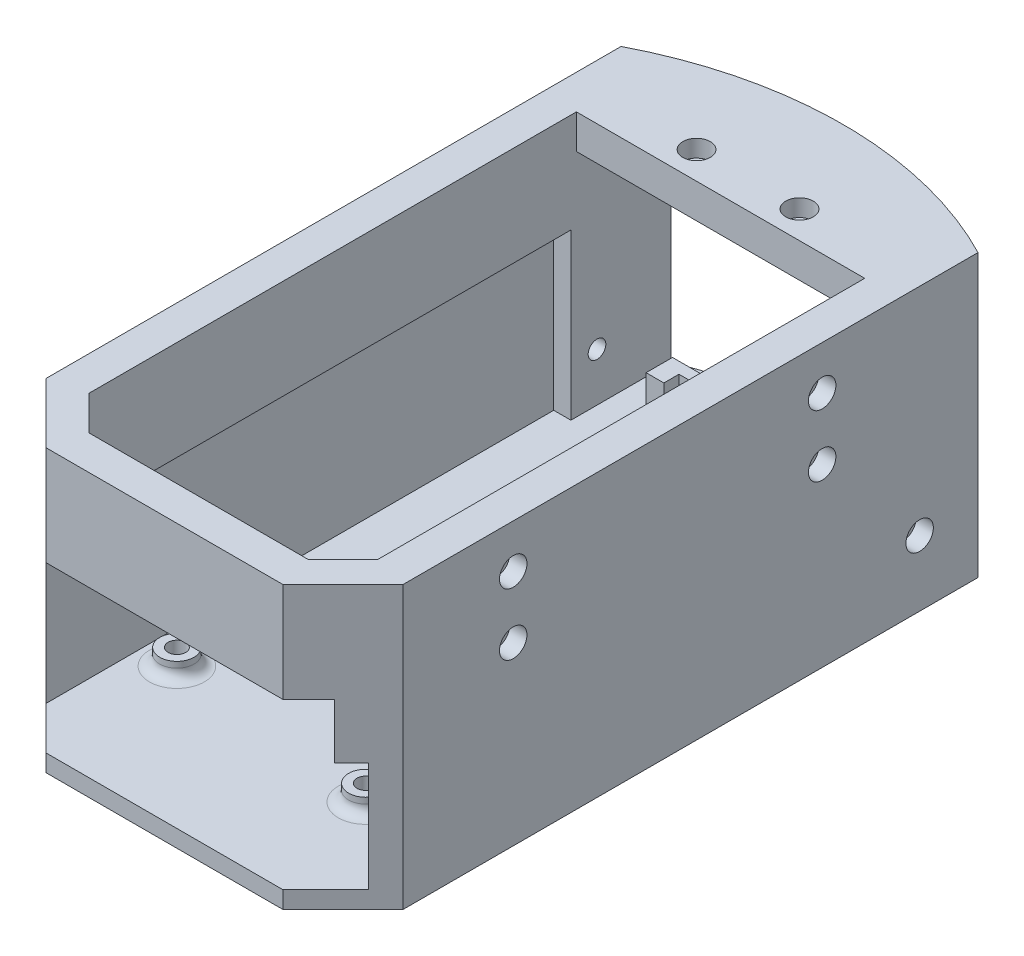
from build123d import *

# Parameters (mm, degrees)
SKETCH1_W                 = 66.04
SKETCH1_H                 = 52.07
SKETCH1_W_2               = 53.34
SKETCH1_H_2               = 42.545
BOSS_EXTRUDE1_DEPTH       = 152.4
SKETCH3_W                 = 53.34
SKETCH3_H                 = 129.7432
CUT_EXTRUDE2_DEPTH        = 48.895
BOSS_EXTRUDE3_DEPTH       = 48.895
SKETCH6_W                 = 177.8
SKETCH6_H                 = 203.2
CUT_EXTRUDE3_DEPTH        = 165.400016119
F_4_CLEARANCE_HOLE3_D     = 3.2639
F_4_CLEARANCE_HOLE3_DEPTH = 6.35
SKETCH12_R                = 2.54
CUT_EXTRUDE5_DEPTH        = 3.175
SKETCH15_R                = 2.54
CUT_EXTRUDE6_DEPTH        = 3.175
CUT_EXTRUDE9_DEPTH        = 101.854
SKETCH18_W                = 29.718
SKETCH18_H                = 4.88696
SD_CARD_HOLDER_DEPTH      = 13.9954
SKETCH19_W                = 24.3332
SKETCH19_H                = 5.6388
CUT_EXTRUDE10_DEPTH       = 2.794
SKETCH20_R                = 3.175
MOUNT_POST_DEPTH          = 3
F_4_CLEARANCE_HOLE1_D     = 3.2639
CUT_EXTRUDE11_DEPTH       = 1.905
F_4_CLEARANCE_HOLE2_D     = 3.2639
F_4_CLEARANCE_HOLE2_DEPTH = 6.35
SKETCH27_R                = 2.54
CUT_EXTRUDE13_DEPTH       = 3.175
FILLET1_R                 = 1.905
FILLET2_R                 = 1.905
CUT_EXTRUDE15_START       = -52.07
CUT_EXTRUDE15_DEPTH       = 52.07
BOSS_EXTRUDE8_DEPTH       = 107.95
FILLET3_R                 = 1.27
SKETCH32_W                = 38.1
SKETCH32_H                = 6.35
CUT_EXTRUDE16_DEPTH       = 146.211577855


with BuildPart() as part:
    # Sketch1 → Boss-Extrude1 (new body)
    with BuildSketch(Plane.XY):
        Rectangle(SKETCH1_W, SKETCH1_H)
        with Locations((0, -1.5875)):
            Rectangle(SKETCH1_W_2, SKETCH1_H_2, mode=Mode.SUBTRACT)
    extrude(amount=BOSS_EXTRUDE1_DEPTH)

    # Sketch3 → Cut-Extrude2 (cut)
    with BuildSketch(Plane(origin=(0, 26.035, 0), x_dir=(1, 0, 0), z_dir=(0, 1, 0))):
        with Locations((0, -87.5284)):
            Rectangle(SKETCH3_W, SKETCH3_H)
    extrude(amount=-CUT_EXTRUDE2_DEPTH, mode=Mode.SUBTRACT)

    # Sketch5 → Boss-Extrude3 (add)
    with BuildSketch(Plane(origin=(0, 26.035, 0), x_dir=(1, 0, 0), z_dir=(0, 1, 0))):
        Polygon((20.32, -119.1768), (26.67, -119.1768), (26.67, -112.8268), align=None)
        Polygon((-26.67, -119.1768), (-20.32, -119.1768), (-26.67, -112.8268), align=None)
        Polygon((0, -152.4), (0, -119.1768), (-20.32, -119.1768), (-26.67, -119.1768), (-26.67, -152.4), align=None)
        Polygon((26.67, -152.4), (26.67, -119.1768), (20.32, -119.1768), (0, -119.1768), (0, -152.4), align=None)
    extrude(amount=-BOSS_EXTRUDE3_DEPTH)

    # Sketch6 → Cut-Extrude3 (cut, through all)
    with BuildSketch(Plane(origin=(0, 26.035, 0), x_dir=(1, 0, 0), z_dir=(0, 1, 0))):
        with Locations((2.791033984, -70.453804893)):
            Rectangle(SKETCH6_W, SKETCH6_H)
        with BuildLine():
            Line((44.5826875, -125.5268), (-44.5826875, -125.5268))
            ThreePointArc((-44.5826875, -125.5268), (-69.844182534, -70.853519983), (-43.18, -16.850445544))
            Line((-43.18, -16.850445544), (-44.357636364, -15.353048604))
            ThreePointArc((-44.357636364, -15.353048604), (0, 0), (44.357636364, -15.353048604))
            Line((44.357636364, -15.353048604), (43.18, -16.850445544))
            ThreePointArc((43.18, -16.850445544), (69.844182534, -70.853519983), (44.5826875, -125.5268))
        make_face(mode=Mode.SUBTRACT)
    extrude(amount=-CUT_EXTRUDE3_DEPTH, mode=Mode.SUBTRACT)

    # #4 Clearance Hole3
    with Locations(Plane(origin=(0, 26.035, 0), x_dir=(1, 0, 0), z_dir=(0, 1, 0))):
        with Locations((-9.525, -17.5768), (9.525, -17.5768)):
            Hole(F_4_CLEARANCE_HOLE3_D / 2, depth=F_4_CLEARANCE_HOLE3_DEPTH)

    # Sketch12 → Cut-Extrude5 (cut)
    with BuildSketch(Plane(origin=(0, 26.035, 0), x_dir=(1, 0, 0), z_dir=(0, 1, 0))):
        with Locations(Location((-9.525, -17.5768, 0), (0, 0, 180))):
            Circle(SKETCH12_R)
        with Locations(Location((9.525, -17.5768, 0), (0, 0, 180))):
            Circle(SKETCH12_R)
    extrude(amount=-CUT_EXTRUDE5_DEPTH, mode=Mode.SUBTRACT)

    # Sketch13 → #4 Clearance Hole4 (revolve, cut)
    with BuildSketch(Plane(origin=(-26.67, -13.9065, 18.8468), x_dir=(0, 0, -1), z_dir=(0, 1, 0))):
        Polygon((0, 0), (0, 13.680574487), (1.63195, 12.7), (1.63195, 0), align=None)
    f_4_clearance_hole4 = revolve(axis=Axis((-20.32, -13.9065, 18.8468), (-1, 0, 0)), mode=Mode.SUBTRACT)

    # Sketch15 → Cut-Extrude6 (cut)
    with BuildSketch(Plane.ZY.offset(33.02)):
        with Locations((18.8468, -13.9065)):
            Circle(SKETCH15_R)
    cut_extrude6 = extrude(amount=-CUT_EXTRUDE6_DEPTH, mode=Mode.SUBTRACT)

    # Mirror1: #4 Clearance Hole4, Cut-Extrude6 across plane
    add(f_4_clearance_hole4.mirror(Plane(origin=(0, 0, 0), x_dir=(0, 0, 1), z_dir=(1, 0, 0))), mode=Mode.SUBTRACT)
    add(cut_extrude6.mirror(Plane(origin=(0, 0, 0), x_dir=(0, 0, 1), z_dir=(1, 0, 0))), mode=Mode.SUBTRACT)

    # Sketch16 → Cut-Extrude9 (cut)
    with BuildSketch(Plane(origin=(0, 0, 125.5268), x_dir=(-1, 0, 0), z_dir=(0, 0, -1))):
        Polygon((-26.67, 7.62), (29.845, 7.62), (29.845, -22.86), (-29.845, -22.86), (-29.845, -2.54), (-26.67, -2.54), align=None)
    extrude(amount=CUT_EXTRUDE9_DEPTH, mode=Mode.SUBTRACT)

    # Sketch18 → SD card holder (add)
    with BuildSketch(Plane(origin=(0, -22.86, 0), x_dir=(1, 0, 0), z_dir=(0, 1, 0))):
        with Locations((1.524, -20.65528)):
            Rectangle(SKETCH18_W, SKETCH18_H)
    extrude(amount=SD_CARD_HOLDER_DEPTH)

    # Sketch19 → Cut-Extrude10 (cut)
    with BuildSketch(Plane.XY.offset(23.09876)):
        with Locations((2.1209, -11.684)):
            Rectangle(SKETCH19_W, SKETCH19_H)
    extrude(amount=-CUT_EXTRUDE10_DEPTH, mode=Mode.SUBTRACT)

    # Sketch20 → mount post (add)
    with BuildSketch(Plane(origin=(0, -22.86, 0), x_dir=(1, 0, 0), z_dir=(0, 1, 0))):
        with Locations(Location((-9.88187, -49.20376, 0), (0, 0, 180))):
            Circle(SKETCH20_R)
        with Locations(Location((15.51813, -103.81376, 0), (0, 0, 180))):
            Circle(SKETCH20_R)
        with Locations(Location((-23.72487, -99.50846, 0), (0, 0, 180))):
            Circle(SKETCH20_R)
    extrude(amount=MOUNT_POST_DEPTH)

    # #4 Clearance Hole1 (through all)
    with Locations(Plane(origin=(0, -19.86, 0), x_dir=(1, 0, 0), z_dir=(0, 1, 0))):
        with Locations((15.51813, -103.81376), (-9.88187, -49.20376), (-23.72487, -99.50846)):
            Hole(F_4_CLEARANCE_HOLE1_D / 2)

    # Sketch23 → Cut-Extrude11 (cut)
    with BuildSketch(Plane.XZ.offset(26.035)):
        Polygon((-7.154236388, 49.20376), (-8.518053194, 51.56596), (-11.245686806, 51.56596), (-12.609503612, 49.20376), (-11.245686806, 46.84156), (-8.518053194, 46.84156), align=None)
        Polygon((18.245763612, 103.81376), (16.881946806, 106.17596), (14.154313194, 106.17596), (12.790496388, 103.81376), (14.154313194, 101.45156), (16.881946806, 101.45156), align=None)
        Polygon((-22.361053194, 97.14626), (-20.997236388, 99.50846), (-22.361053194, 101.87066), (-25.088686806, 101.87066), (-26.452503612, 99.50846), (-25.088686806, 97.14626), align=None)
    extrude(amount=-CUT_EXTRUDE11_DEPTH, mode=Mode.SUBTRACT)

    # #4 Clearance Hole2
    with Locations(Plane(origin=(33.02, 0, 0), x_dir=(0, 0, -1), z_dir=(1, 0, 0))):
        with Locations((-94.0308, 17.93875), (-94.0308, 6.50875), (-36.8808, 17.93875), (-36.8808, 6.50875)):
            Hole(F_4_CLEARANCE_HOLE2_D / 2, depth=F_4_CLEARANCE_HOLE2_DEPTH)

    # Sketch27 → Cut-Extrude13 (cut)
    with BuildSketch(Plane(origin=(33.02, 0, 0), x_dir=(0, 0, -1), z_dir=(1, 0, 0))):
        with Locations((-94.0308, 17.93875)):
            Circle(SKETCH27_R)
        with Locations((-94.0308, 6.50875)):
            Circle(SKETCH27_R)
        with Locations((-36.8808, 17.93875)):
            Circle(SKETCH27_R)
        with Locations((-36.8808, 6.50875)):
            Circle(SKETCH27_R)
    extrude(amount=-CUT_EXTRUDE13_DEPTH, mode=Mode.SUBTRACT)

    # Fillet1
    fillet1_edges = [part.edges().sort_by_distance(p)[0] for p in [
        (-13.335, -22.86, 20.65528),
        (16.383, -22.86, 20.65528),
        (1.524, -22.86, 18.2118),
    ]]
    fillet(fillet1_edges, radius=FILLET1_R)

    # Fillet2
    fillet2_edges = [part.edges().sort_by_distance(p)[0] for p in [
        (-6.70687, -22.86, 49.20376),
        (18.69313, -22.86, 103.81376),
        (-20.54987, -22.86, 99.50846),
    ]]
    fillet(fillet2_edges, radius=FILLET2_R)

    # Sketch28 → Cut-Extrude15 (cut)
    with BuildSketch(Plane(origin=(0, 26.035, 0), x_dir=(1, 0, 0), z_dir=(0, 1, 0)).offset(CUT_EXTRUDE15_START)):
        Polygon((40.411152545, -107.038724254), (0, -147.449876798), (-40.411152545, -107.038724254), (-54.779562339, -121.407134047), (0, -176.186696386), (54.779562339, -121.407134047), align=None)
    extrude(amount=CUT_EXTRUDE15_DEPTH, mode=Mode.SUBTRACT)

    # Sketch31 → Boss-Extrude8 (add)
    with BuildSketch(Plane.XY.offset(125.5268)):
        Polygon((3.175, -26.035), (-3.175, -26.035), (-3.175, -27.94), (-6.35, -27.94), (-6.35, -31.115), (6.35, -31.115), (6.35, -27.94), (3.175, -27.94), align=None)
    extrude(amount=-BOSS_EXTRUDE8_DEPTH)

    # Fillet3
    fillet3_edges = [part.edges().sort_by_distance(p)[0] for p in [
        (6.35, -29.5275, 125.5268),
        (6.35, -27.94, 71.5518),
        (6.35, -31.115, 71.5518),
        (-6.35, -29.5275, 17.5768),
        (-6.35, -31.115, 71.5518),
        (-6.35, -27.94, 71.5518),
        (6.35, -29.5275, 17.5768),
        (-6.35, -29.5275, 125.5268),
    ]]
    fillet(fillet3_edges, radius=FILLET3_R)

    # Sketch32 → Cut-Extrude16 (cut, through all)
    with BuildSketch(Plane.ZY.offset(33.02)):
        with Locations((106.4768, -29.21)):
            Rectangle(SKETCH32_W, SKETCH32_H)
    extrude(amount=-CUT_EXTRUDE16_DEPTH, mode=Mode.SUBTRACT)


solid = part.part
